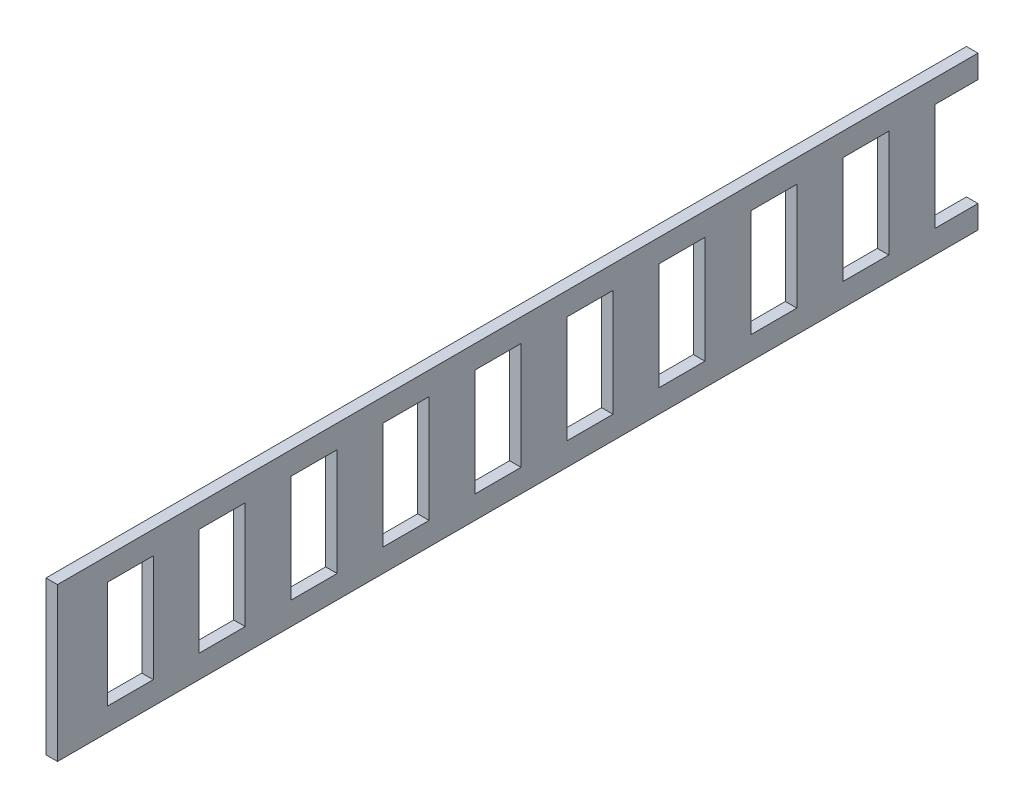
from build123d import *

# Parameters (mm, degrees)
SKETCH1_W           = 60
SKETCH1_H           = 140
BOSS_EXTRUDE1_DEPTH = 15


with BuildPart() as part:
    # Sketch1 → Boss-Extrude1 (new body)
    with BuildSketch(Plane(origin=(0, 0, 0), x_dir=(0, 0, -1), z_dir=(1, 0, 0))):
        Polygon((-600.7, 0), (600.7, 0), (600.7, 30), (544.3, 30), (544.3, 170), (600.7, 170), (600.7, 200), (-600.7, 200), align=None)
        with Locations((-505.7, 100)):
            Rectangle(SKETCH1_W, SKETCH1_H, mode=Mode.SUBTRACT)
        with Locations((-385.7, 100)):
            Rectangle(SKETCH1_W, SKETCH1_H, mode=Mode.SUBTRACT)
        with Locations((-265.7, 100)):
            Rectangle(SKETCH1_W, SKETCH1_H, mode=Mode.SUBTRACT)
        with Locations((-145.7, 100)):
            Rectangle(SKETCH1_W, SKETCH1_H, mode=Mode.SUBTRACT)
        with Locations((-25.7, 100)):
            Rectangle(SKETCH1_W, SKETCH1_H, mode=Mode.SUBTRACT)
        with Locations((94.3, 100)):
            Rectangle(SKETCH1_W, SKETCH1_H, mode=Mode.SUBTRACT)
        with Locations((214.3, 100)):
            Rectangle(SKETCH1_W, SKETCH1_H, mode=Mode.SUBTRACT)
        with Locations((334.3, 100)):
            Rectangle(SKETCH1_W, SKETCH1_H, mode=Mode.SUBTRACT)
        with Locations((454.3, 100)):
            Rectangle(SKETCH1_W, SKETCH1_H, mode=Mode.SUBTRACT)
    extrude(amount=BOSS_EXTRUDE1_DEPTH)


solid = part.part
